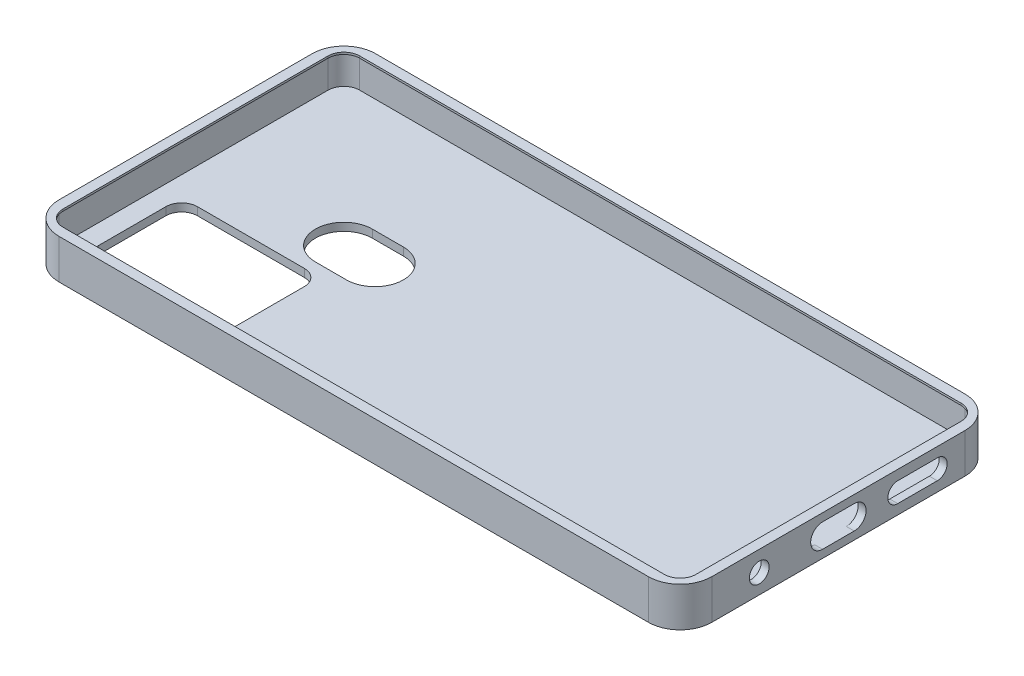
from build123d import *

# Parameters (mm, degrees)
BOSS_EXTRUDE1_DEPTH = 10
CUT_EXTRUDE1_DEPTH  = 8
CUT_EXTRUDE2_DEPTH  = 8
SKETCH4_R           = 2.5
CUT_EXTRUDE3_DEPTH  = 8
BOSS_EXTRUDE2_DEPTH = 0.5


with BuildPart() as part:
    # Sketch1 → Boss-Extrude1 (new body)
    with BuildSketch(Plane(origin=(0, 0, 0), x_dir=(1, 0, 0), z_dir=(0, 1, 0))):
        with BuildLine():
            Line((-74.5, 40), (74.5, 40))
            ThreePointArc((74.5, 40), (80.156854249, 37.656854249), (82.5, 32))
            Line((82.5, 32), (82.5, -32))
            ThreePointArc((82.5, -32), (80.156854249, -37.656854249), (74.5, -40))
            Line((74.5, -40), (-74.5, -40))
            ThreePointArc((-74.5, -40), (-80.156854249, -37.656854249), (-82.5, -32))
            Line((-82.5, -32), (-82.5, 32))
            ThreePointArc((-82.5, 32), (-80.156854249, 37.656854249), (-74.5, 40))
        make_face()
    extrude(amount=BOSS_EXTRUDE1_DEPTH)

    # Sketch2 → Cut-Extrude1 (cut)
    with BuildSketch(Plane(origin=(0, 10, 0), x_dir=(1, 0, 0), z_dir=(0, 1, 0))):
        with BuildLine():
            Line((-76.5, 38), (76.5, 38))
            ThreePointArc((76.5, 38), (79.328427125, 36.828427125), (80.5, 34))
            Line((80.5, 34), (80.5, -34))
            ThreePointArc((80.5, -34), (79.328427125, -36.828427125), (76.5, -38))
            Line((76.5, -38), (-76.5, -38))
            ThreePointArc((-76.5, -38), (-79.328427125, -36.828427125), (-80.5, -34))
            Line((-80.5, -34), (-80.5, 34))
            ThreePointArc((-80.5, 34), (-79.328427125, 36.828427125), (-76.5, 38))
        make_face()
    extrude(amount=-CUT_EXTRUDE1_DEPTH, mode=Mode.SUBTRACT)

    # Sketch3 → Cut-Extrude2 (cut)
    with BuildSketch(Plane(origin=(0, 2, 0), x_dir=(1, 0, 0), z_dir=(0, 1, 0))):
        with BuildLine():
            Line((-71.5, -8), (-44.5, -8))
            ThreePointArc((-44.5, -8), (-41.671572875, -9.171572875), (-40.5, -12))
            Line((-40.5, -12), (-40.5, -29))
            ThreePointArc((-40.5, -29), (-41.671572875, -31.828427125), (-44.5, -33))
            Line((-44.5, -33), (-71.5, -33))
            ThreePointArc((-71.5, -33), (-74.328427125, -31.828427125), (-75.5, -29))
            Line((-75.5, -29), (-75.5, -12))
            ThreePointArc((-75.5, -12), (-74.328427125, -9.171572875), (-71.5, -8))
        make_face()
        with BuildLine():
            Line((-44.5, 9.198469839), (-36.645114423, 9.198469839))
            ThreePointArc((-36.645114423, 9.198469839), (-29.446644584, 2), (-36.645114423, -5.198469839))
            Line((-36.645114423, -5.198469839), (-44.5, -5.198469839))
            ThreePointArc((-44.5, -5.198469839), (-51.698469839, 2), (-44.5, 9.198469839))
        make_face()
    extrude(amount=-CUT_EXTRUDE2_DEPTH, mode=Mode.SUBTRACT)

    # Sketch4 → Cut-Extrude3 (cut)
    with BuildSketch(Plane(origin=(82.5, 0, 0), x_dir=(0, 0, -1), z_dir=(1, 0, 0))):
        with Locations((-20, 4.917165975)):
            Circle(SKETCH4_R)
        with BuildLine():
            Line((-4, 8), (4, 8))
            ThreePointArc((4, 8), (7, 5), (4, 2))
            Line((4, 2), (-4, 2))
            ThreePointArc((-4, 2), (-7, 5), (-4, 8))
        make_face()
        with BuildLine():
            Line((15, 7.5), (25, 7.5))
            ThreePointArc((25, 7.5), (27.5, 5), (25, 2.5))
            Line((25, 2.5), (15, 2.5))
            ThreePointArc((15, 2.5), (12.5, 5), (15, 7.5))
        make_face()
    extrude(amount=-CUT_EXTRUDE3_DEPTH, mode=Mode.SUBTRACT)

    # Sketch6 → Boss-Extrude2 (add)
    with BuildSketch(Plane(origin=(0, 10, 0), x_dir=(1, 0, 0), z_dir=(0, 1, 0))):
        with BuildLine():
            Line((80.5, -34), (80.5, 34))
            ThreePointArc((80.5, 34), (79.328427125, 36.828427125), (76.5, 38))
            Line((76.5, 38), (-76.5, 38))
            ThreePointArc((-76.5, 38), (-79.328427125, 36.828427125), (-80.5, 34))
            Line((-80.5, 34), (-80.5, -34))
            ThreePointArc((-80.5, -34), (-79.328427125, -36.828427125), (-76.5, -38))
            Line((-76.5, -38), (76.5, -38))
            ThreePointArc((76.5, -38), (79.328427125, -36.828427125), (80.5, -34))
        make_face()
        with BuildLine():
            Line((-76, 37.5), (76, 37.5))
            ThreePointArc((76, 37.5), (78.828427125, 36.328427125), (80, 33.5))
            Line((80, 33.5), (80, -33.5))
            ThreePointArc((80, -33.5), (78.828427125, -36.328427125), (76, -37.5))
            Line((76, -37.5), (-76, -37.5))
            ThreePointArc((-76, -37.5), (-78.828427125, -36.328427125), (-80, -33.5))
            Line((-80, -33.5), (-80, 33.5))
            ThreePointArc((-80, 33.5), (-78.828427125, 36.328427125), (-76, 37.5))
        make_face(mode=Mode.SUBTRACT)
    extrude(amount=-BOSS_EXTRUDE2_DEPTH)


solid = part.part
